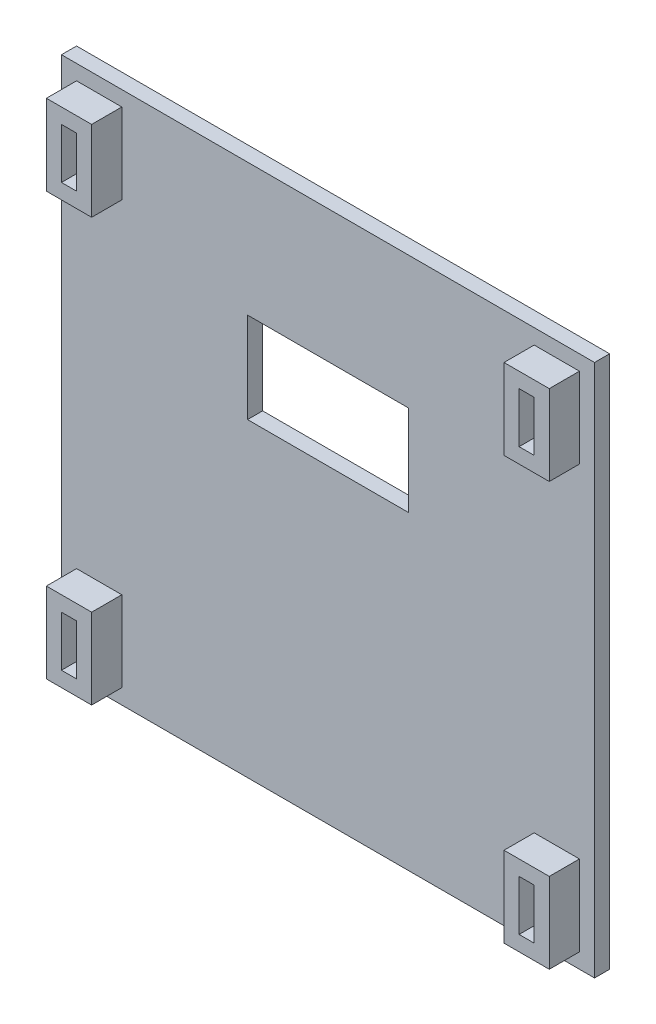
from build123d import *

# Parameters (mm, degrees)
SKETCH1_W               = 53
SKETCH1_H               = 53
BOSS_EXTRUDE1_DEPTH     = 1.5
SKETCH2_W               = 16
SKETCH2_H               = 9
CUT_EXTRUDE1_DEPTH      = 75.968326645
SKETCH3_W               = 4.5
SKETCH3_H               = 8
BOSS_EXTRUDE2_DEPTH     = 3
SKETCH4_W               = 1.5
SKETCH4_H               = 5.000000074
CUT_EXTRUDE2_DEPTH      = 3
MIRROR2_COPY_1_SKETCH_W = 4.5
MIRROR2_COPY_1_SKETCH_H = 8
MIRROR2_COPY_1_DEPTH    = 3
MIRROR2_COPY_2_SKETCH_W = 1.5
MIRROR2_COPY_2_SKETCH_H = 5.000000074
MIRROR2_COPY_2_DEPTH    = 3


with BuildPart() as part:
    # Sketch1 → Boss-Extrude1 (new body)
    with BuildSketch(Plane.XY.offset(1.5)):
        with Locations((26.5, 26.5)):
            Rectangle(SKETCH1_W, SKETCH1_H)
    extrude(amount=-BOSS_EXTRUDE1_DEPTH)

    # Sketch2 → Cut-Extrude1 (cut, through all)
    with BuildSketch(Plane(origin=(0, 0, 0), x_dir=(-1, 0, 0), z_dir=(0, 0, -1))):
        with Locations((-26.5, 35.333333333)):
            Rectangle(SKETCH2_W, SKETCH2_H)
    extrude(amount=-CUT_EXTRUDE1_DEPTH, mode=Mode.SUBTRACT)

    # Sketch3 → Boss-Extrude2 (add)
    with BuildSketch(Plane.XY.offset(1.5)):
        with Locations((3.75, 47.5)):
            Rectangle(SKETCH3_W, SKETCH3_H)
    boss_extrude2 = extrude(amount=BOSS_EXTRUDE2_DEPTH)

    # Sketch4 → Cut-Extrude2 (cut)
    with BuildSketch(Plane.XY.offset(4.5)):
        with Locations((3.75, 47.5)):
            Rectangle(SKETCH4_W, SKETCH4_H)
    cut_extrude2 = extrude(amount=-CUT_EXTRUDE2_DEPTH, mode=Mode.SUBTRACT)

    # Mirror1: Boss-Extrude2, Cut-Extrude2 across plane
    add(boss_extrude2.mirror(Plane.ZY.offset(-26.5)))
    add(cut_extrude2.mirror(Plane.ZY.offset(-26.5)), mode=Mode.SUBTRACT)

    # Mirror2: Boss-Extrude2, Cut-Extrude2 across plane
    add(boss_extrude2.mirror(Plane.ZX.offset(26.5)))
    add(cut_extrude2.mirror(Plane.ZX.offset(26.5)), mode=Mode.SUBTRACT)

    # Mirror2 copy 1 sketch → Mirror2 copy 1 (add)
    with BuildSketch(Plane(origin=(53, 53, 1.5), x_dir=(-1, 0, 0), z_dir=(0, 0, 1))):
        with Locations((3.75, 47.5)):
            Rectangle(MIRROR2_COPY_1_SKETCH_W, MIRROR2_COPY_1_SKETCH_H)
    extrude(amount=MIRROR2_COPY_1_DEPTH)

    # Mirror2 copy 2 sketch → Mirror2 copy 2 (cut)
    with BuildSketch(Plane(origin=(53, 53, 4.5), x_dir=(-1, 0, 0), z_dir=(0, 0, 1))):
        with Locations((3.75, 47.5)):
            Rectangle(MIRROR2_COPY_2_SKETCH_W, MIRROR2_COPY_2_SKETCH_H)
    extrude(amount=-MIRROR2_COPY_2_DEPTH, mode=Mode.SUBTRACT)


solid = part.part
